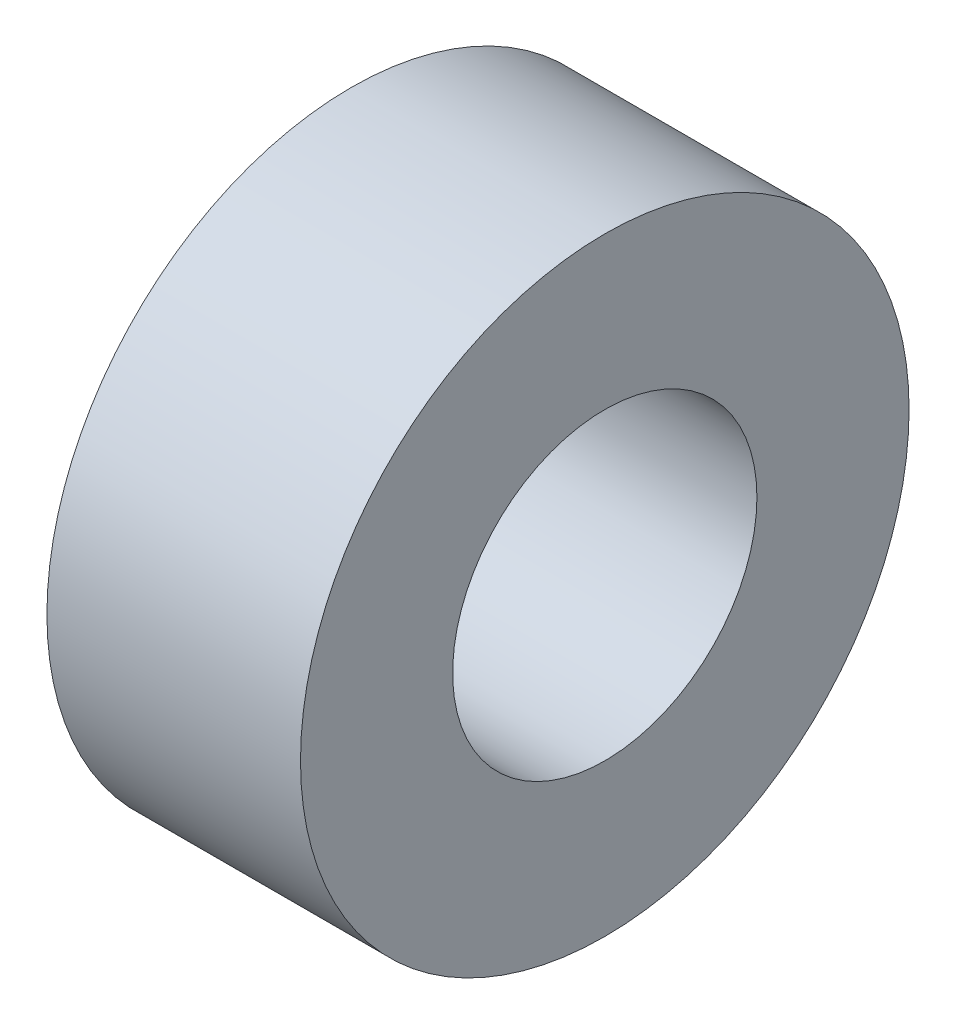
from build123d import *

# Parameters (mm, degrees)
SKETCH1_W = 2.5
SKETCH1_H = 1.5


with BuildPart() as part:
    # Sketch1 → Revolve1 (revolve)
    with BuildSketch(Plane(origin=(0, 0, 0), x_dir=(-1, 0, 0), z_dir=(0, 0, -1)), mode=Mode.PRIVATE) as revolve1_sk:
        with Locations((0, 2.25)):
            Rectangle(SKETCH1_W, SKETCH1_H)
    revolve(revolve1_sk.sketch.rotate(Axis((2.895672476, 0, 0), (-1, 0, 0)), 90), axis=Axis((2.895672476, 0, 0), (-1, 0, 0)))


solid = part.part
